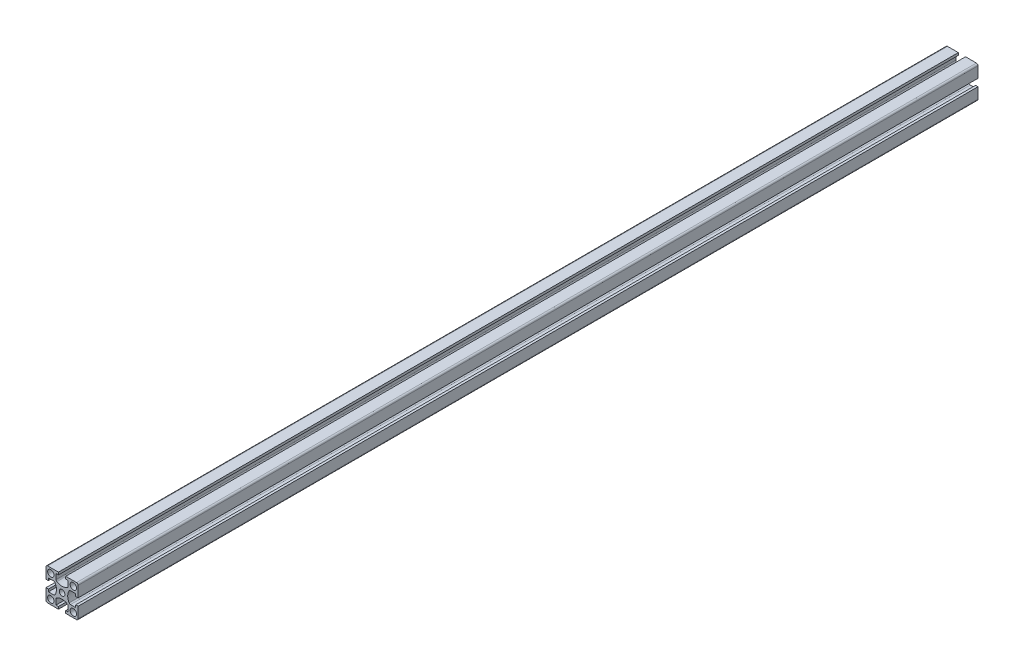
from build123d import *

# Parameters (mm, degrees)
SKETCH1_R           = 2.5
SKETCH1_R_2         = 2.1875
BOSS_EXTRUDE1_DEPTH = 700


with BuildPart() as part:
    # Sketch1 → Boss-Extrude1 (new body)
    with BuildSketch(Plane.XY):
        with BuildLine():
            Line((-12.5, 11.25), (-12.5, 2.8125))
            Line((-12.5, 2.8125), (-10.625, 2.8125))
            Line((-10.625, 2.8125), (-10.625, 4.6875))
            Line((-10.625, 4.6875), (-6.546075349, 4.6875))
            ThreePointArc((-6.546075349, 4.6875), (-5.921075349, 4.520031755), (-5.463543594, 4.0625))
            ThreePointArc((-5.463543594, 4.0625), (-4.375, 0), (-5.463543594, -4.0625))
            ThreePointArc((-5.463543594, -4.0625), (-5.921075349, -4.520031755), (-6.546075349, -4.6875))
            Line((-6.546075349, -4.6875), (-10.625, -4.6875))
            Line((-10.625, -4.6875), (-10.625, -2.8125))
            Line((-10.625, -2.8125), (-12.5, -2.8125))
            Line((-12.5, -2.8125), (-12.5, -11.25))
            ThreePointArc((-12.5, -11.25), (-12.133883476, -12.133883476), (-11.25, -12.5))
            Line((-11.25, -12.5), (-2.8125, -12.5))
            Line((-2.8125, -12.5), (-2.8125, -10.625))
            Line((-2.8125, -10.625), (-4.6875, -10.625))
            Line((-4.6875, -10.625), (-4.6875, -6.546075349))
            ThreePointArc((-4.6875, -6.546075349), (-4.520031755, -5.921075349), (-4.0625, -5.463543594))
            ThreePointArc((-4.0625, -5.463543594), (0, -4.375), (4.0625, -5.463543594))
            ThreePointArc((4.0625, -5.463543594), (4.520031755, -5.921075349), (4.6875, -6.546075349))
            Line((4.6875, -6.546075349), (4.6875, -10.625))
            Line((4.6875, -10.625), (2.8125, -10.625))
            Line((2.8125, -10.625), (2.8125, -12.5))
            Line((2.8125, -12.5), (11.25, -12.5))
            ThreePointArc((11.25, -12.5), (12.133883476, -12.133883476), (12.5, -11.25))
            Line((12.5, -11.25), (12.5, -2.8125))
            Line((12.5, -2.8125), (10.625, -2.8125))
            Line((10.625, -2.8125), (10.625, -4.6875))
            Line((10.625, -4.6875), (6.546075349, -4.6875))
            ThreePointArc((6.546075349, -4.6875), (5.921075349, -4.520031755), (5.463543594, -4.0625))
            ThreePointArc((5.463543594, -4.0625), (4.375, 0), (5.463543594, 4.0625))
            ThreePointArc((5.463543594, 4.0625), (5.921075349, 4.520031755), (6.546075349, 4.6875))
            Line((6.546075349, 4.6875), (10.625, 4.6875))
            Line((10.625, 4.6875), (10.625, 2.8125))
            Line((10.625, 2.8125), (12.5, 2.8125))
            Line((12.5, 2.8125), (12.5, 11.25))
            ThreePointArc((12.5, 11.25), (12.133883476, 12.133883476), (11.25, 12.5))
            Line((11.25, 12.5), (2.8125, 12.5))
            Line((2.8125, 12.5), (2.8125, 10.625))
            Line((2.8125, 10.625), (4.6875, 10.625))
            Line((4.6875, 10.625), (4.6875, 6.546075349))
            ThreePointArc((4.6875, 6.546075349), (4.520031755, 5.921075349), (4.0625, 5.463543594))
            ThreePointArc((4.0625, 5.463543594), (0, 4.375), (-4.0625, 5.463543594))
            ThreePointArc((-4.0625, 5.463543594), (-4.520031755, 5.921075349), (-4.6875, 6.546075349))
            Line((-4.6875, 6.546075349), (-4.6875, 10.625))
            Line((-4.6875, 10.625), (-2.8125, 10.625))
            Line((-2.8125, 10.625), (-2.8125, 12.5))
            Line((-2.8125, 12.5), (-11.25, 12.5))
            ThreePointArc((-11.25, 12.5), (-12.133883476, 12.133883476), (-12.5, 11.25))
        make_face()
        with Locations((-8.75, -8.75)):
            Circle(SKETCH1_R, mode=Mode.SUBTRACT)
        with Locations((8.75, -8.75)):
            Circle(SKETCH1_R, mode=Mode.SUBTRACT)
        with Locations((8.75, 8.75)):
            Circle(SKETCH1_R, mode=Mode.SUBTRACT)
        Circle(SKETCH1_R_2, mode=Mode.SUBTRACT)
        with Locations((-8.75, 8.75)):
            Circle(SKETCH1_R, mode=Mode.SUBTRACT)
    extrude(amount=BOSS_EXTRUDE1_DEPTH)


solid = part.part
